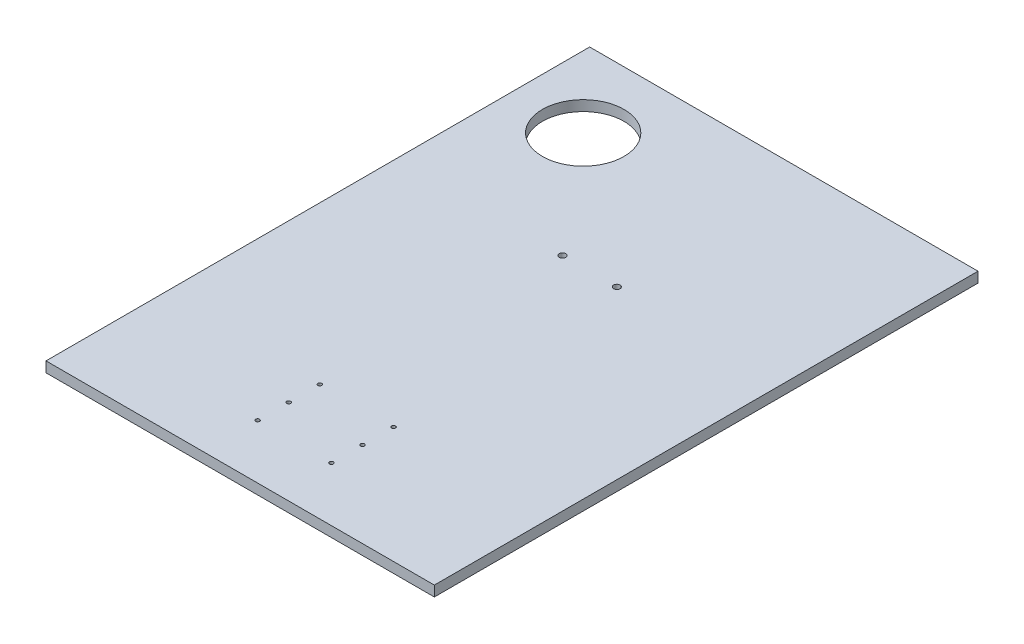
from build123d import *

# Parameters (mm, degrees)
SKETCH1_W           = 300
SKETCH1_H           = 420
SKETCH1_R           = 2.5
SKETCH1_R_2         = 1.5
SKETCH1_R_3         = 31.5
BOSS_EXTRUDE1_DEPTH = 8


with BuildPart() as part:
    # Sketch1 → Boss-Extrude1 (new body)
    with BuildSketch(Plane(origin=(0, 0, 0), x_dir=(1, 0, 0), z_dir=(0, 1, 0))):
        Rectangle(SKETCH1_W, SKETCH1_H)
        with Locations(Location((-21, 60, 0), (0, 0, 270))):
            Circle(SKETCH1_R, mode=Mode.SUBTRACT)
        with Locations(Location((21, 60, 0), (0, 0, 90))):
            Circle(SKETCH1_R, mode=Mode.SUBTRACT)
        with Locations(Location((-28.5, -120, 0), (0, 0, 270))):
            Circle(SKETCH1_R_2, mode=Mode.SUBTRACT)
        with Locations(Location((-28.5, -144, 0), (0, 0, 270))):
            Circle(SKETCH1_R_2, mode=Mode.SUBTRACT)
        with Locations(Location((-28.5, -168, 0), (0, 0, 270))):
            Circle(SKETCH1_R_2, mode=Mode.SUBTRACT)
        with Locations(Location((28.5, -168, 0), (0, 0, 90))):
            Circle(SKETCH1_R_2, mode=Mode.SUBTRACT)
        with Locations(Location((28.5, -144, 0), (0, 0, 90))):
            Circle(SKETCH1_R_2, mode=Mode.SUBTRACT)
        with Locations(Location((28.5, -120, 0), (0, 0, 90))):
            Circle(SKETCH1_R_2, mode=Mode.SUBTRACT)
        with Locations(Location((-95, 150, 0), (0, 0, 270))):
            Circle(SKETCH1_R_3, mode=Mode.SUBTRACT)
    extrude(amount=BOSS_EXTRUDE1_DEPTH)


solid = part.part
